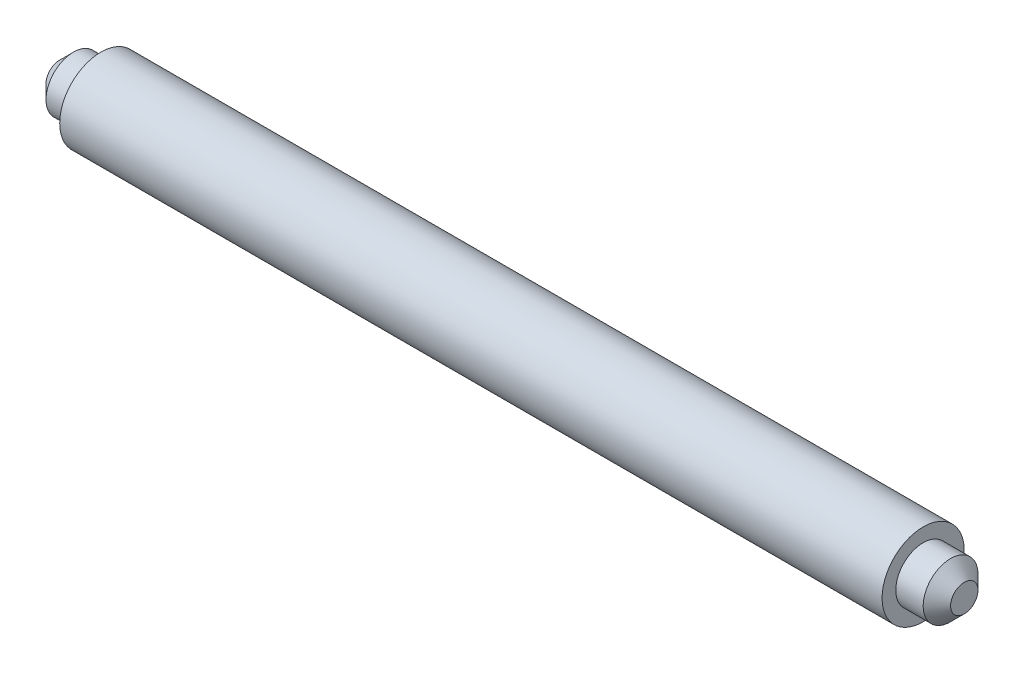
from build123d import *

# Parameters (mm, degrees)
CHANFREIN1_SIZE = 1


with BuildPart() as part:
    # Esquisse1 → Base-Révolution (revolve)
    with BuildSketch(Plane.XY, mode=Mode.PRIVATE) as base_r_volution_sk:
        Polygon((-33, 2), (-33, 0), (33, 0), (33, 2), (30, 2), (30, 3), (-30, 3), (-30, 2), align=None)
    revolve(base_r_volution_sk.sketch.rotate(Axis((-77, 0, 0), (1, 0, 0)), 90), axis=Axis((-77, 0, 0), (1, 0, 0)))

    # Chanfrein1
    chanfrein1_edges = [part.edges().sort_by_distance(p)[0] for p in [
        (-33, 0, -2),
        (33, 0, -2),
    ]]
    chamfer(chanfrein1_edges, length=CHANFREIN1_SIZE)


solid = part.part
